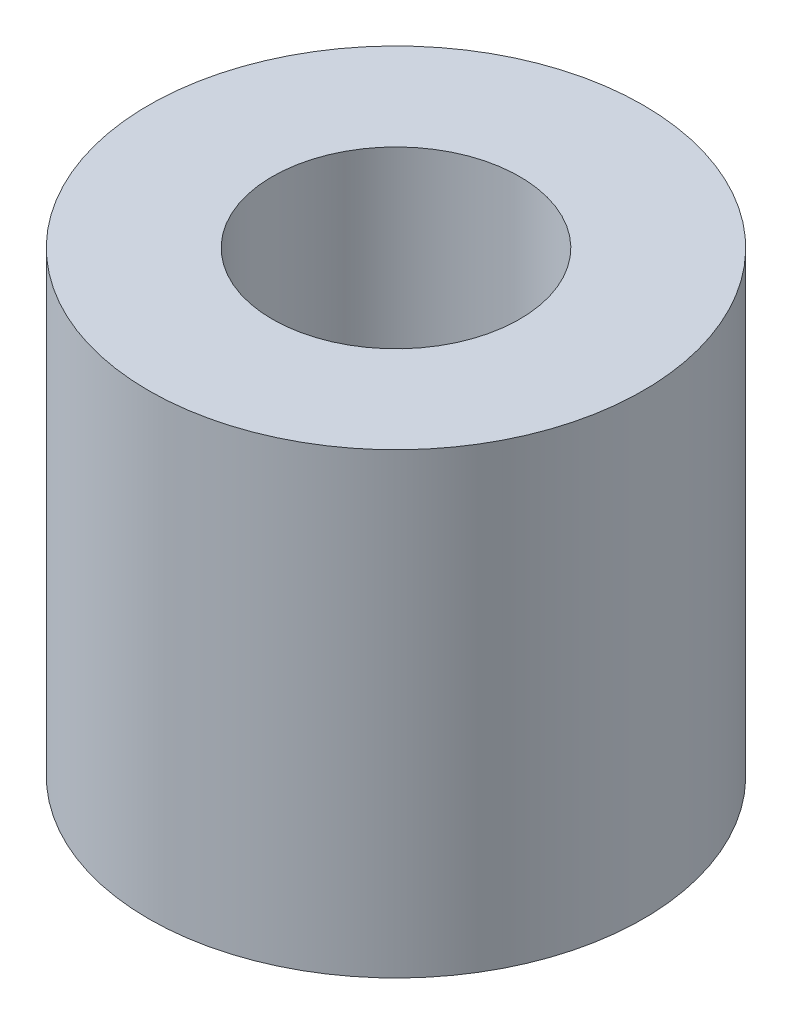
from build123d import *

# Parameters (mm, degrees)
SKETCH1_R           = 5.08
SKETCH1_R_2         = 2.54
BOSS_EXTRUDE1_DEPTH = 9.398


with BuildPart() as part:
    # Sketch1 → Boss-Extrude1 (new body)
    with BuildSketch(Plane(origin=(0, 0, 0), x_dir=(1, 0, 0), z_dir=(0, 1, 0))):
        with Locations(Location((0, 0, 0), (0, 0, 270))):
            Circle(SKETCH1_R)
        with Locations(Location((0, 0, 0), (0, 0, 270))):
            Circle(SKETCH1_R_2, mode=Mode.SUBTRACT)
    extrude(amount=BOSS_EXTRUDE1_DEPTH)


solid = part.part
